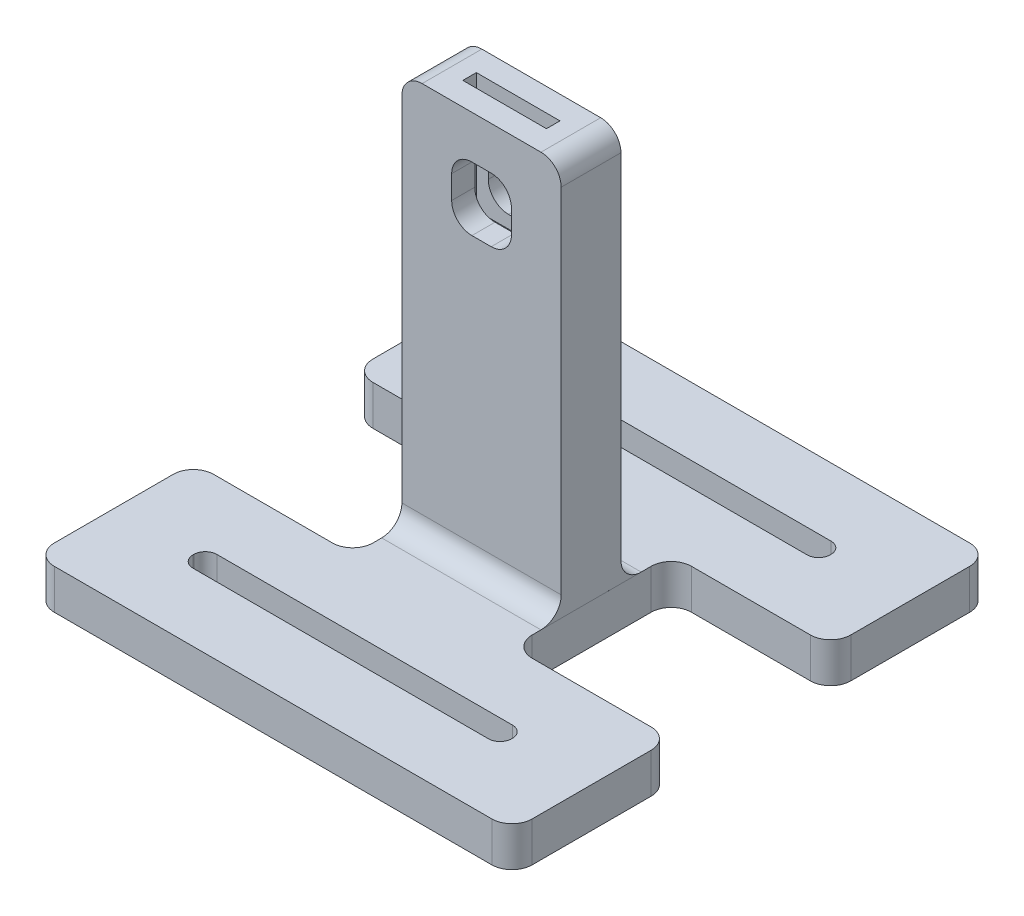
from build123d import *

# Parameters (mm, degrees)
BOSS_EXTRUDE1_DEPTH = 5
CUT_EXTRUDE1_DEPTH  = 43.772012023
FILLET1_R           = 2.54
SKETCH3_W           = 20
SKETCH3_H           = 7.5
BOSS_EXTRUDE2_DEPTH = 34.4
SKETCH4_W           = 4.75
SKETCH4_H           = 1.7
BOSS_EXTRUDE3_DEPTH = 15
CUT_EXTRUDE2_DEPTH  = 71.664569081
FILLET2_R           = 2.54


with BuildPart() as part:
    # Sketch1 → Boss-Extrude1 (new body)
    with BuildSketch(Plane(origin=(0, 0, 0), x_dir=(1, 0, 0), z_dir=(0, 1, 0))):
        Polygon((-29.999623956, -29.926382831), (30.000376044, -29.926382831), (30.000376044, -9.926382831), (10.000376044, -9.926382831), (10.000376044, 10.073617169), (30.000376044, 10.073617169), (30.000376044, 30.073617169), (-29.999623956, 30.073617169), (-29.999623956, 10.073617169), (-9.999623956, 10.073617169), (-9.999623956, -9.926382831), (-29.999623956, -9.926382831), align=None)
    extrude(amount=BOSS_EXTRUDE1_DEPTH)

    # Sketch2 → Cut-Extrude1 (cut, through all)
    with BuildSketch(Plane(origin=(0, 5, 0), x_dir=(1, 0, 0), z_dir=(0, 1, 0))):
        with BuildLine():
            Line((-18.549247911, 18.573617169), (18.55, 18.573617169))
            ThreePointArc((18.55, 18.573617169), (19.575304833, 18.998312337), (20, 20.023617169))
            Line((20, 20.023617169), (20, 20.123617169))
            ThreePointArc((20, 20.123617169), (19.575304833, 21.148922002), (18.55, 21.573617169))
            Line((18.55, 21.573617169), (-18.549247911, 21.573617169))
            ThreePointArc((-18.549247911, 21.573617169), (-19.574552744, 21.148922002), (-19.999247911, 20.123617169))
            Line((-19.999247911, 20.123617169), (-19.999247911, 20.023617169))
            ThreePointArc((-19.999247911, 20.023617169), (-19.574552744, 18.998312337), (-18.549247911, 18.573617169))
        make_face()
        with BuildLine():
            Line((-18.549623956, -21.426382831), (18.550376044, -21.426382831))
            ThreePointArc((18.550376044, -21.426382831), (19.575680877, -21.001687663), (20.000376044, -19.976382831))
            Line((20.000376044, -19.976382831), (20.000376044, -19.876382831))
            ThreePointArc((20.000376044, -19.876382831), (19.575680877, -18.851077998), (18.550376044, -18.426382831))
            Line((18.550376044, -18.426382831), (-18.549623956, -18.426382831))
            ThreePointArc((-18.549623956, -18.426382831), (-19.574928788, -18.851077998), (-19.999623956, -19.876382831))
            Line((-19.999623956, -19.876382831), (-19.999623956, -19.976382831))
            ThreePointArc((-19.999623956, -19.976382831), (-19.574928788, -21.001687663), (-18.549623956, -21.426382831))
        make_face()
    extrude(amount=-CUT_EXTRUDE1_DEPTH, mode=Mode.SUBTRACT)

    # Fillet1
    fillet1_edges = [part.edges().sort_by_distance(p)[0] for p in [
        (-29.999623956, 2.5, -10.073617169),
        (-29.999623956, 2.5, -30.073617169),
        (30.000376044, 2.5, -30.073617169),
        (30.000376044, 2.5, -10.073617169),
        (10.000376044, 2.5, -10.073617169),
        (10.000376044, 2.5, 9.926382831),
        (30.000376044, 2.5, 9.926382831),
        (30.000376044, 2.5, 29.926382831),
        (-29.999623956, 2.5, 29.926382831),
        (-29.999623956, 2.5, 9.926382831),
        (-9.999623956, 2.5, 9.926382831),
        (-9.999623956, 2.5, -10.073617169),
    ]]
    fillet(fillet1_edges, radius=FILLET1_R)

    # Sketch3 → Boss-Extrude2 (add)
    with BuildSketch(Plane(origin=(0, 5, 0), x_dir=(1, 0, 0), z_dir=(0, 1, 0))):
        Rectangle(SKETCH3_W, SKETCH3_H)
    extrude(amount=BOSS_EXTRUDE2_DEPTH)

    # Sketch4 → Boss-Extrude3 (add)
    with BuildSketch(Plane(origin=(0, 39.4, 0), x_dir=(1, 0, 0), z_dir=(0, 1, 0))):
        Polygon((10, -3.75), (10, -0.85), (5.25, -0.85), (-5.25, -0.85), (-10, -0.85), (-10, -3.75), align=None)
        with Locations((7.625, 0)):
            Rectangle(SKETCH4_W, SKETCH4_H)
        Polygon((5.25, 0.85), (10, 0.85), (10, 3.75), (-10, 3.75), (-10, 0.85), (-5.25, 0.85), align=None)
        with Locations((-7.625, 0)):
            Rectangle(SKETCH4_W, SKETCH4_H)
    extrude(amount=BOSS_EXTRUDE3_DEPTH)

    # Sketch5 → Cut-Extrude2 (cut, through all)
    with BuildSketch(Plane(origin=(0, 0, -3.75), x_dir=(-1, 0, 0), z_dir=(0, 0, -1))):
        with BuildLine():
            Line((-1.21, 41), (1.21, 41))
            ThreePointArc((1.21, 41), (3.006051224, 41.743948776), (3.75, 43.54))
            Line((3.75, 43.54), (3.75, 46.46))
            ThreePointArc((3.75, 46.46), (3.006051224, 48.256051224), (1.21, 49))
            Line((1.21, 49), (-1.21, 49))
            ThreePointArc((-1.21, 49), (-3.006051224, 48.256051224), (-3.75, 46.46))
            Line((-3.75, 46.46), (-3.75, 43.54))
            ThreePointArc((-3.75, 43.54), (-3.006051224, 41.743948776), (-1.21, 41))
        make_face()
    extrude(amount=-CUT_EXTRUDE2_DEPTH, mode=Mode.SUBTRACT)

    # Fillet2
    fillet2_edges = [part.edges().sort_by_distance(p)[0] for p in [
        (0.000188022, 5, 3.75),
        (0.000188022, 5, -3.75),
        (-10, 54.4, 0),
        (10, 54.4, 0),
    ]]
    fillet(fillet2_edges, radius=FILLET2_R)


solid = part.part
